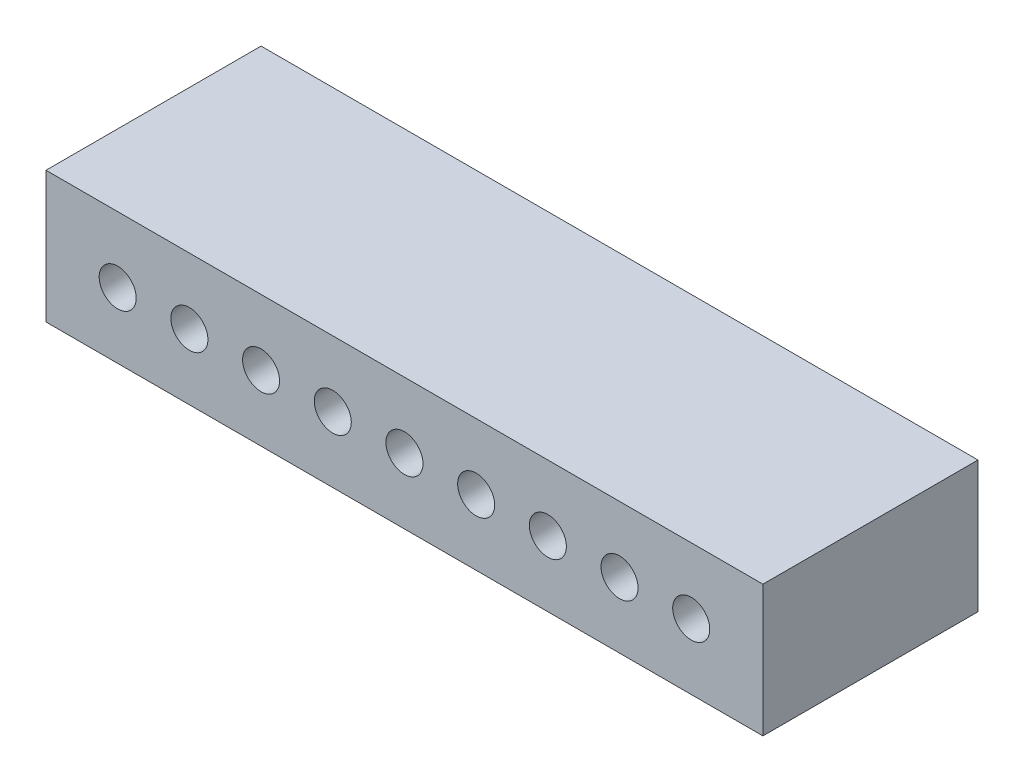
from build123d import *

# Parameters (mm, degrees)
SKETCH_1_W          = 60
SKETCH_1_H          = 18
EXTRUDE_1_DEPTH     = 11
SKETCH_2_R          = 1.55
CUT_EXTRUDE_2_DEPTH = 37.674241642


with BuildPart() as part:
    # 草图1 → 凸台-拉伸1 (new body)
    with BuildSketch(Plane(origin=(0, 0, 0), x_dir=(1, 0, 0), z_dir=(0, 1, 0))):
        Rectangle(SKETCH_1_W, SKETCH_1_H)
    extrude(amount=EXTRUDE_1_DEPTH)

    # 草图2 → 切除-拉伸2 (cut, through all)
    with BuildSketch(Plane.XY.offset(9)):
        with Locations((-24, 5.5)):
            Circle(SKETCH_2_R)
        with Locations((-18, 5.5)):
            Circle(SKETCH_2_R)
        with Locations((-12, 5.5)):
            Circle(SKETCH_2_R)
        with Locations((-6, 5.5)):
            Circle(SKETCH_2_R)
        with Locations((0, 5.5)):
            Circle(SKETCH_2_R)
        with Locations((6, 5.5)):
            Circle(SKETCH_2_R)
        with Locations((12, 5.5)):
            Circle(SKETCH_2_R)
        with Locations((18, 5.5)):
            Circle(SKETCH_2_R)
        with Locations((24, 5.5)):
            Circle(SKETCH_2_R)
    extrude(amount=-CUT_EXTRUDE_2_DEPTH, mode=Mode.SUBTRACT)


solid = part.part
